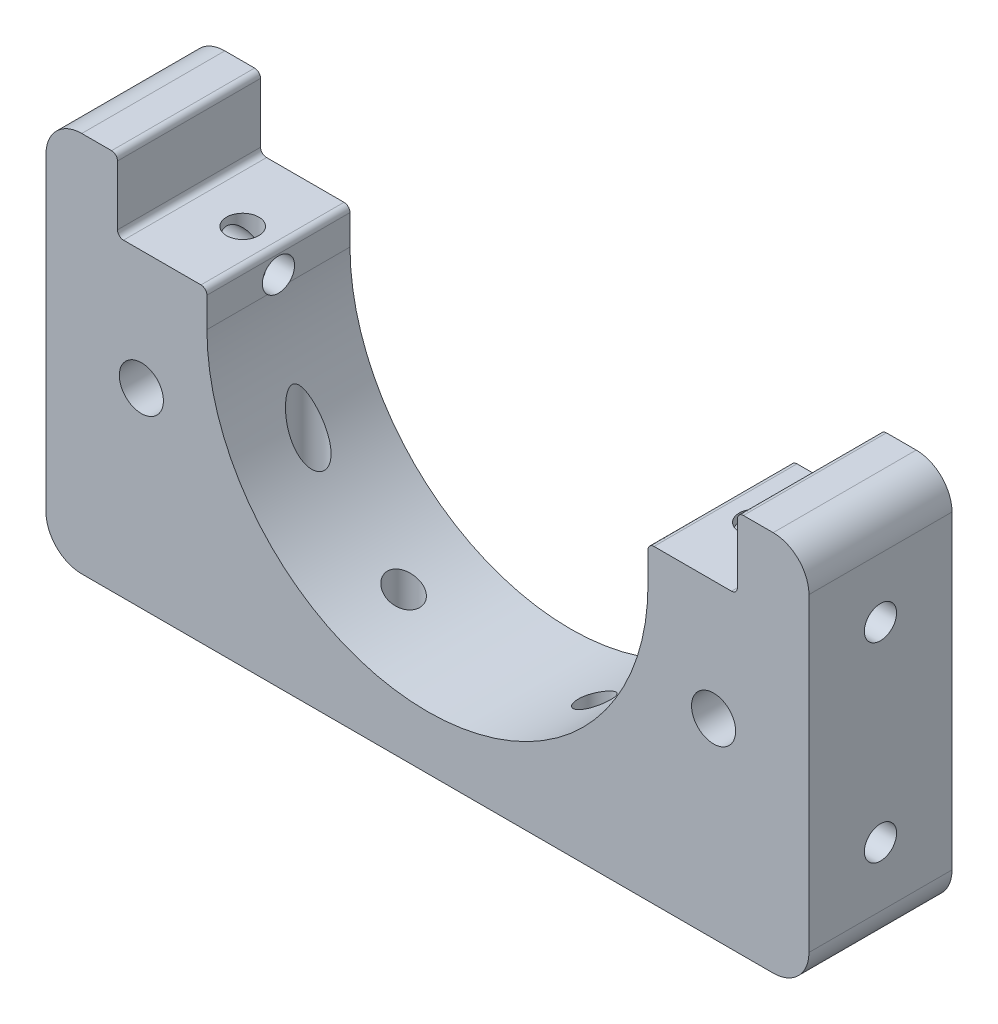
from build123d import *

# Parameters (mm, degrees)
SKETCH1_W                  = 64
SKETCH1_H                  = 32
BOSS_EXTRUDE1_DEPTH        = 12
CUT_EXTRUDE1_DEPTH         = 43.941821107
SKETCH3_W                  = 7.5
SKETCH3_H                  = 6
CUT_EXTRUDE2_DEPTH         = 43.941821107
M2_5_CLEARANCE_HOLE1_D     = 2.7051
M2_5_CLEARANCE_HOLE1_DEPTH = 32
M2_5_CLEARANCE_HOLE2_D     = 2.7051
M2_5_CLEARANCE_HOLE2_DEPTH = 32
F_3_7_3_7_DIAMETER_HOLE1_D = 3.7
M2_5_CLEARANCE_HOLE3_D     = 2.7051
M2_5_CLEARANCE_HOLE3_DEPTH = 12
M2_5_CLEARANCE_HOLE3_TIP   = 0.560244554
F_3_7_3_7_DIAMETER_HOLE2_D = 3.7
M2_5_CLEARANCE_HOLE4_D     = 2.7051
M2_5_CLEARANCE_HOLE4_DEPTH = 74.5
M2_5_CLEARANCE_HOLE5_D     = 2.7051
M2_5_CLEARANCE_HOLE5_DEPTH = 10.5
M2_5_CLEARANCE_HOLE5_TIP   = 0.560244554
M2_5_CLEARANCE_HOLE6_D     = 2.7051
M2_5_CLEARANCE_HOLE6_DEPTH = 10.5
M2_5_CLEARANCE_HOLE6_TIP   = 0.560244554
FILLET1_R                  = 0.5
FILLET2_R                  = 3


with BuildPart() as part:
    # Sketch1 → Boss-Extrude1 (new body)
    with BuildSketch(Plane(origin=(0, 0, -6), x_dir=(-1, 0, 0), z_dir=(0, 0, -1))):
        with Locations((0, -10)):
            Rectangle(SKETCH1_W, SKETCH1_H)
    extrude(amount=-BOSS_EXTRUDE1_DEPTH)

    # Sketch2 → Cut-Extrude1 (cut, through all)
    with BuildSketch(Plane.XY.offset(6)):
        with BuildLine():
            Line((-26, 6), (-26, 0))
            Line((-26, 0), (-18.5, 0))
            Line((-18.5, 0), (-18.5, -3))
            ThreePointArc((-18.5, -3), (0, -21.5), (18.5, -3))
            Line((18.5, -3), (18.5, 6))
            Line((18.5, 6), (-26, 6))
        make_face()
    extrude(amount=-CUT_EXTRUDE1_DEPTH, mode=Mode.SUBTRACT)

    # Sketch3 → Cut-Extrude2 (cut, through all)
    with BuildSketch(Plane.XY.offset(6)):
        with Locations((22.25, 3)):
            Rectangle(SKETCH3_W, SKETCH3_H)
    extrude(amount=-CUT_EXTRUDE2_DEPTH, mode=Mode.SUBTRACT)

    # M2.5 Clearance Hole1
    with Locations(Plane(origin=(0, -26, 0), x_dir=(-1, 0, 0), z_dir=(0, -1, 0))):
        with Locations((8, 0), (-8, 0)):
            Hole(M2_5_CLEARANCE_HOLE1_D / 2, depth=M2_5_CLEARANCE_HOLE1_DEPTH)

    # M2.5 Clearance Hole2
    with Locations(Plane(origin=(0, -26, 0), x_dir=(-1, 0, 0), z_dir=(0, -1, 0))):
        with Locations((16, 0), (-16, 0)):
            Hole(M2_5_CLEARANCE_HOLE2_D / 2, depth=M2_5_CLEARANCE_HOLE2_DEPTH)

    # Ø3.7 (3.7) Diameter Hole1 (through all)
    with Locations(Plane(origin=(0, 0, -6), x_dir=(-1, 0, 0), z_dir=(0, 0, -1))):
        with Locations((24, -10)):
            Hole(F_3_7_3_7_DIAMETER_HOLE1_D / 2)

    # M2.5 Clearance Hole3
    with Locations(Plane(origin=(0, 0, 0), x_dir=(1, 0, 0), z_dir=(0, 1, 0))):
        with Locations((21.5, 0), (-21.5, 0)):
            Hole(M2_5_CLEARANCE_HOLE3_D / 2, depth=M2_5_CLEARANCE_HOLE3_DEPTH)
            with Locations((0, 0, -(M2_5_CLEARANCE_HOLE3_DEPTH + M2_5_CLEARANCE_HOLE3_TIP / 2))):  # 135° drill point
                Cone(0, M2_5_CLEARANCE_HOLE3_D / 2, M2_5_CLEARANCE_HOLE3_TIP, mode=Mode.SUBTRACT)

    # Ø3.7 (3.7) Diameter Hole2 (through all)
    with Locations(Plane.XY.offset(6)):
        with Locations((24, -10)):
            Hole(F_3_7_3_7_DIAMETER_HOLE2_D / 2)

    # M2.5 Clearance Hole4
    with Locations(Plane(origin=(32, 0, 0), x_dir=(0, 0, -1), z_dir=(1, 0, 0))):
        with Locations((0, -2)):
            Hole(M2_5_CLEARANCE_HOLE4_D / 2, depth=M2_5_CLEARANCE_HOLE4_DEPTH)

    # M2.5 Clearance Hole5
    with Locations(Plane(origin=(32, 0, 0), x_dir=(0, 0, -1), z_dir=(1, 0, 0))):
        with Locations((0, -18)):
            Hole(M2_5_CLEARANCE_HOLE5_D / 2, depth=M2_5_CLEARANCE_HOLE5_DEPTH)
            with Locations((0, 0, -(M2_5_CLEARANCE_HOLE5_DEPTH + M2_5_CLEARANCE_HOLE5_TIP / 2))):  # 135° drill point
                Cone(0, M2_5_CLEARANCE_HOLE5_D / 2, M2_5_CLEARANCE_HOLE5_TIP, mode=Mode.SUBTRACT)

    # M2.5 Clearance Hole6
    with Locations(Plane.ZY.offset(32)):
        with Locations((0, -18)):
            Hole(M2_5_CLEARANCE_HOLE6_D / 2, depth=M2_5_CLEARANCE_HOLE6_DEPTH)
            with Locations((0, 0, -(M2_5_CLEARANCE_HOLE6_DEPTH + M2_5_CLEARANCE_HOLE6_TIP / 2))):  # 135° drill point
                Cone(0, M2_5_CLEARANCE_HOLE6_D / 2, M2_5_CLEARANCE_HOLE6_TIP, mode=Mode.SUBTRACT)

    # Fillet1
    fillet1_edges = [part.edges().sort_by_distance(p)[0] for p in [
        (-26, 6, 0),
        (-18.5, 0, 0),
        (-26, 0, 0),
        (18.5, 0, 0),
        (26, 6, 0),
        (26, 0, 0),
    ]]
    fillet(fillet1_edges, radius=FILLET1_R)

    # Fillet2
    fillet2_edges = [part.edges().sort_by_distance(p)[0] for p in [
        (32, -26, 0),
        (32, 6, 0),
        (-32, 6, 0),
        (-32, -26, 0),
    ]]
    fillet(fillet2_edges, radius=FILLET2_R)


solid = part.part
